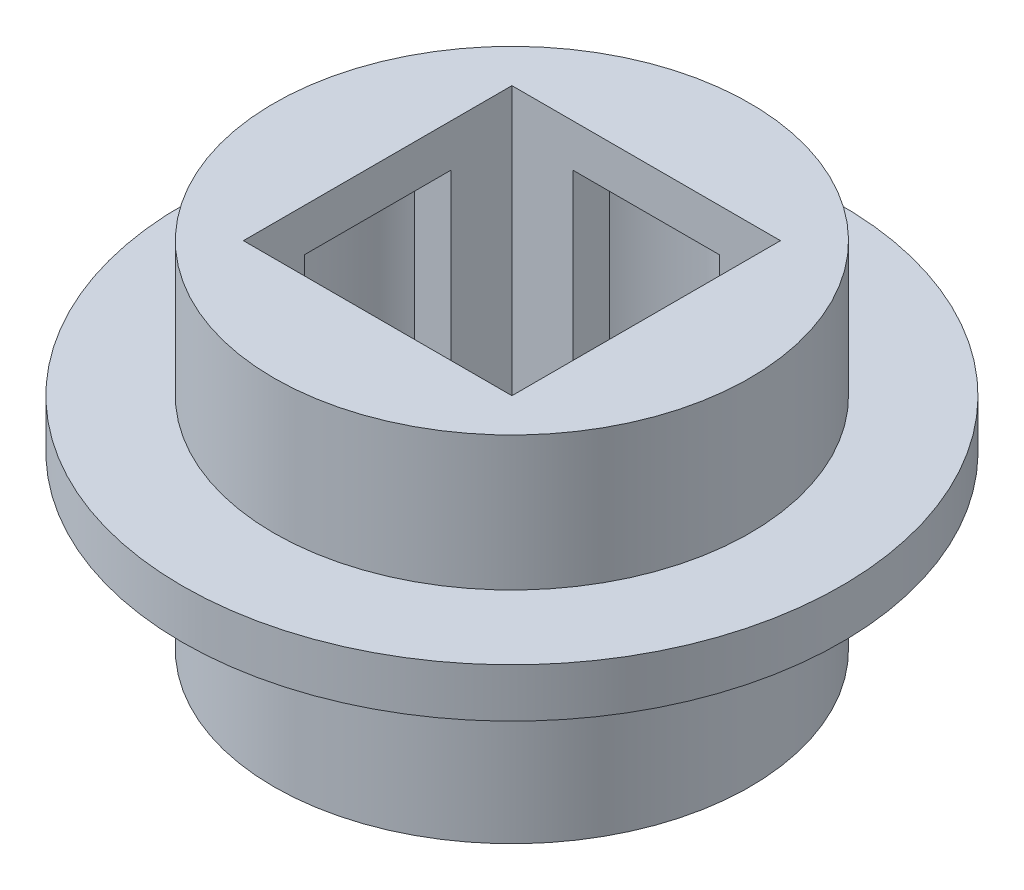
from build123d import *

# Parameters (mm, degrees)
SKETCH1_R                = 27
SKETCH1_R_2              = 19.5
BOSS_EXTRUDE1_DEPTH      = 4
BOSS_EXTRUDE2_DEPTH      = 11
BOSS_EXTRUDE2_DEPTH_BACK = 18
SKETCH2_R                = 19.5
SKETCH3_W                = 22
SKETCH3_H                = 22
CUT_EXTRUDE1_DEPTH       = 29
CUT_EXTRUDE2_DEPTH       = 25.5


with BuildPart() as part:
    # Sketch1 → Boss-Extrude1 (new body)
    with BuildSketch(Plane(origin=(0, 0, 0), x_dir=(1, 0, 0), z_dir=(0, 1, 0))):
        with Locations(Location((0, 0, 0), (0, 0, 270))):
            Circle(SKETCH1_R)
        with Locations(Location((0, 0, 0), (0, 0, 270))):
            Circle(SKETCH1_R_2, mode=Mode.SUBTRACT)
    extrude(amount=BOSS_EXTRUDE1_DEPTH)


with BuildPart() as body_2:
    # Sketch2 → Boss-Extrude2 (new, two sides: drawn at the far end of the back side and taken through both)
    with BuildSketch(Plane(origin=(0, 4, 0), x_dir=(1, 0, 0), z_dir=(0, 1, 0)).offset(-BOSS_EXTRUDE2_DEPTH_BACK)):
        with Locations(Location((0, 0, 0), (0, 0, 270))):
            Circle(SKETCH2_R)
    extrude(amount=BOSS_EXTRUDE2_DEPTH + BOSS_EXTRUDE2_DEPTH_BACK)

    # Sketch3 → Cut-Extrude1 (cut)
    with BuildSketch(Plane(origin=(0, 15, 0), x_dir=(1, 0, 0), z_dir=(0, 1, 0))):
        Rectangle(SKETCH3_W, SKETCH3_H)
    extrude(amount=-CUT_EXTRUDE1_DEPTH, mode=Mode.SUBTRACT)

    # Sketch4 → Cut-Extrude2 (cut)
    with BuildSketch(Plane.XZ.offset(14)):
        with BuildLine():
            Line((11, 6), (11, -6))
            Line((11, -6), (14, -6))
            ThreePointArc((14, -6), (16.485281374, 0), (14, 6))
            Line((14, 6), (11, 6))
        make_face()
        with BuildLine():
            Line((-6, 11), (6, 11))
            Line((6, 11), (6, 14))
            ThreePointArc((6, 14), (0, 16.485281374), (-6, 14))
            Line((-6, 14), (-6, 11))
        make_face()
        with BuildLine():
            Line((6, -11), (-6, -11))
            Line((-6, -11), (-6, -14))
            ThreePointArc((-6, -14), (0, -16.485281374), (6, -14))
            Line((6, -14), (6, -11))
        make_face()
        with BuildLine():
            Line((-11, -6), (-11, 6))
            Line((-11, 6), (-14, 6))
            ThreePointArc((-14, 6), (-16.485281374, 0), (-14, -6))
            Line((-14, -6), (-11, -6))
        make_face()
    extrude(amount=-CUT_EXTRUDE2_DEPTH, mode=Mode.SUBTRACT)


solid = Compound([part.part, body_2.part])
